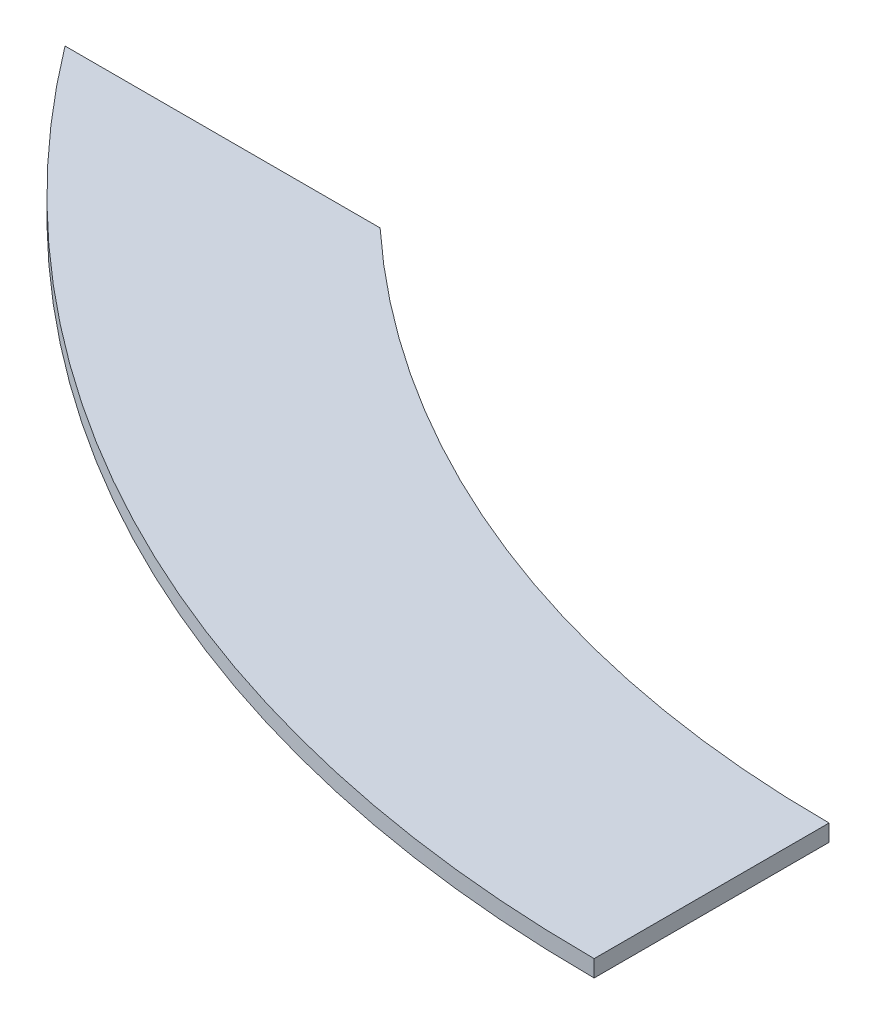
from build123d import *

# Parameters (mm, degrees)
BOSS_EXTRUDE1_DEPTH = 6.35
SKETCH3_W           = 88.9
SKETCH3_H           = 6.35
BOSS_EXTRUDE2_DEPTH = 80


with BuildPart() as part:
    # Sketch2 → Boss-Extrude1 (new body)
    with BuildSketch(Plane(origin=(0, 0, 0), x_dir=(1, 0, 0), z_dir=(0, 1, 0))):
        with BuildLine():
            ThreePointArc((0, -411.1), (-290.691597746, -290.691597746), (-411.1, 0))
            Line((-411.1, 0), (-500, 0))
            ThreePointArc((-500, 0), (-353.553390593, -353.553390593), (0, -500))
            Line((0, -500), (0, -411.1))
        make_face()
    extrude(amount=BOSS_EXTRUDE1_DEPTH)

    # Sketch3 → Boss-Extrude2 (add)
    with BuildSketch(Plane(origin=(0, 0, 0), x_dir=(-1, 0, 0), z_dir=(0, 0, -1))):
        with Locations((455.55, 3.175)):
            Rectangle(SKETCH3_W, SKETCH3_H)
    extrude(amount=BOSS_EXTRUDE2_DEPTH)

    # Split1
    split(bisect_by=Plane(origin=(0, 0, 301), x_dir=(-1, 0, 0), z_dir=(0, 0, -1)), keep=Keep.BOTTOM)


solid = part.part
